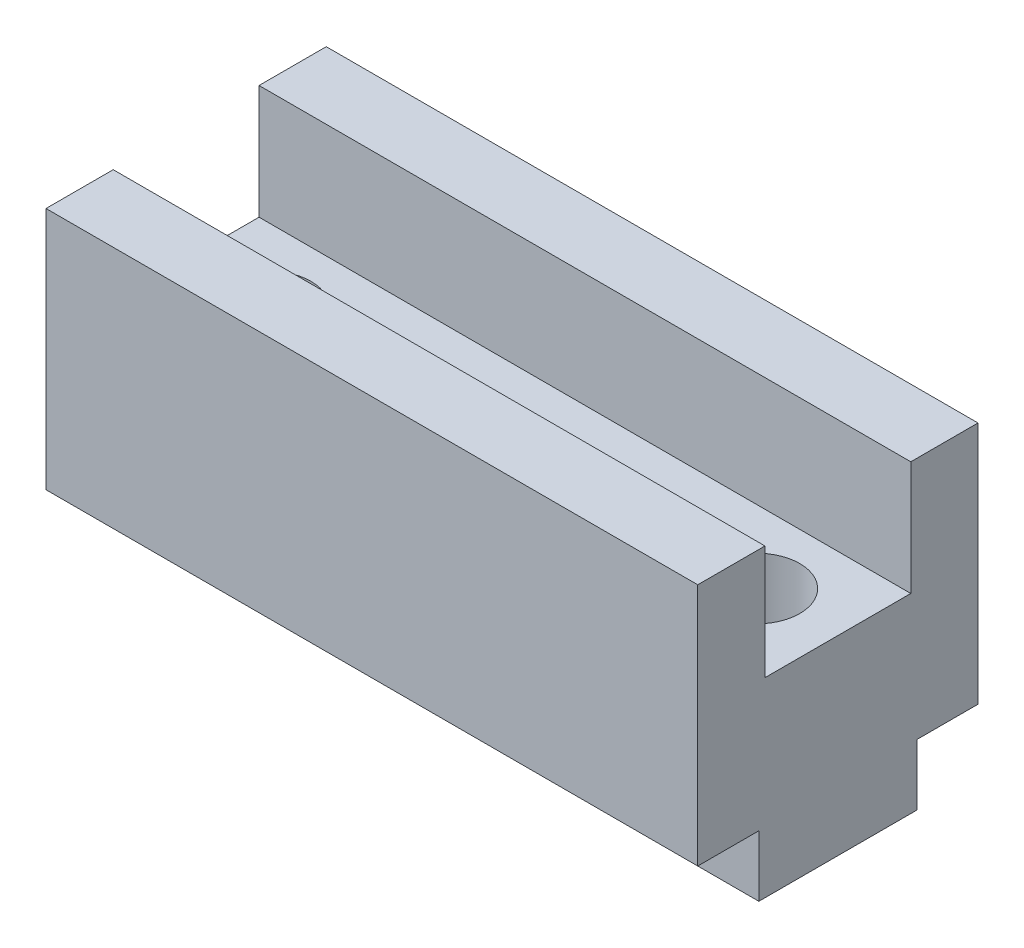
from build123d import *

# Parameters (mm, degrees)
SKETCH1_W                            = 50.8
SKETCH1_H                            = 21.844
STOCK_DEPTH                          = 23.749
CLEARANCE_HOLES_FOR_MOUNTING_BOLTS_D = 6.7564
SKETCH5_W                            = 50.8
SKETCH5_H                            = 4.7625
CLEARANCE_RABBIT_DEPTH               = 4.7625
SKETCH6_W                            = 11.3665
SKETCH6_H                            = 17.78
NUT_SLOT_DEPTH                       = 58.130946824


with BuildPart() as part:
    # Sketch1 → Stock (new body)
    with BuildSketch(Plane(origin=(0, 0, 0), x_dir=(1, 0, 0), z_dir=(0, 1, 0))):
        Rectangle(SKETCH1_W, SKETCH1_H)
    extrude(amount=STOCK_DEPTH)

    # Clearance holes for Mounting Bolts (through all)
    with Locations(Plane(origin=(0, 23.749, 0), x_dir=(1, 0, 0), z_dir=(0, 1, 0))):
        with Locations((-19.05, 0), (19.05, 0)):
            Hole(CLEARANCE_HOLES_FOR_MOUNTING_BOLTS_D / 2)

    # Sketch5 → Clearance Rabbit (cut)
    with BuildSketch(Plane.XZ):
        with Locations((0, 8.54075)):
            Rectangle(SKETCH5_W, SKETCH5_H)
        with Locations((0, -8.54075)):
            Rectangle(SKETCH5_W, SKETCH5_H)
    extrude(amount=-CLEARANCE_RABBIT_DEPTH, mode=Mode.SUBTRACT)

    # Sketch6 → Nut Slot (cut, through all)
    with BuildSketch(Plane(origin=(25.4, 0, 0), x_dir=(0, 0, -1), z_dir=(1, 0, 0))):
        with Locations((0, 23.749)):
            Rectangle(SKETCH6_W, SKETCH6_H)
    extrude(amount=-NUT_SLOT_DEPTH, mode=Mode.SUBTRACT)


solid = part.part
